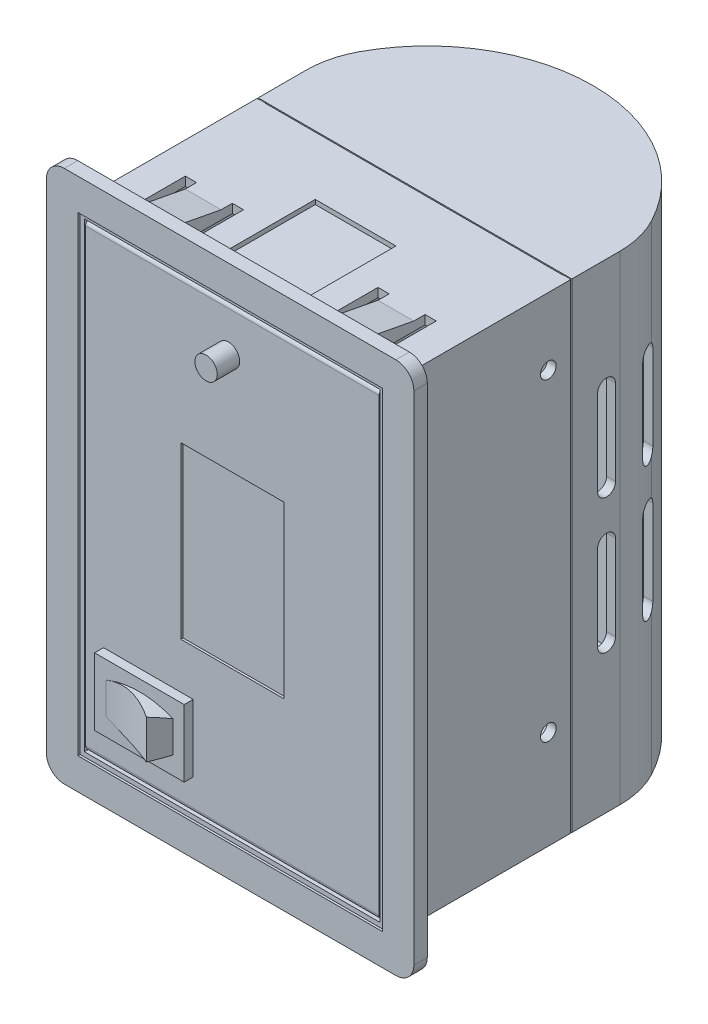
from build123d import *

# Parameters (mm, degrees)
SKETCH_1_W             = 70
SKETCH_1_H             = 107
SKETCH_1_W_2           = 66
SKETCH_1_H_2           = 103
EXTRUDE_1_DEPTH        = 38
SKETCH_2_W             = 66
SKETCH_2_H             = 103
EXTRUDE_2_DEPTH        = 3
SKETCH_3_W             = 68
SKETCH_3_H             = 105
CUT_EXTRUDE_1_DEPTH    = 0.5
SKETCH_4_W             = 18
SKETCH_4_H             = 25
CUT_EXTRUDE_2_DEPTH    = 1
EXTRUDE_3_DEPTH        = 1
CUT_EXTRUDE_3_REACH    = 106.868
SKETCH_6_R             = 1.75
EXTRUDE_4_DEPTH        = 65.5
SKETCH_10_W            = 20
SKETCH_10_H            = 15
EXTRUDE_5_DEPTH        = 2
EXTRUDE_6_DEPTH        = 3.5
CUT_EXTRUDE_4_DEPTH    = 15
CUT_EXTRUDE_5_DEPTH    = 15
SKETCH_14_R            = 2.5
EXTRUDE_7_DEPTH        = 5
SKETCH_15_W            = 23
SKETCH_15_H            = 38
CUT_EXTRUDE_6_DEPTH    = 0.5
EXTRUDE_8_DEPTH        = 107
CUT_EXTRUDE_8_REACH    = 108.744
SKETCH_17_W            = 0.25
SKETCH_17_H            = 0.1
EXTRUDE_START          = -2
EXTRUDE_9_DEPTH        = 2
SKETCH_19_W            = 13
SKETCH_19_H            = 15
CUT_EXTRUDE_9_DEPTH    = 2
EXTRUDE_10_DEPTH       = 8
PATTERN_LINEAR_1_COUNT = 2
PATTERN_LINEAR_1_PITCH = 43
MIRROR_3_COPY_1_DEPTH  = 8
CUT_EXTRUDE_10_REACH   = 108.922
PATTERN_LINEAR_2_COUNT = 2
PATTERN_LINEAR_2_PITCH = 11
SKETCH_22_R            = 2.5
CUT_EXTRUDE_11_DEPTH   = 2


with BuildPart() as part:
    # Эскиз1 → Бобышка-Вытянуть1 (new body)
    with BuildSketch(Plane.XY):
        Rectangle(SKETCH_1_W, SKETCH_1_H)
        Rectangle(SKETCH_1_W_2, SKETCH_1_H_2, mode=Mode.SUBTRACT)
    extrude(amount=EXTRUDE_1_DEPTH)

    # Эскиз2 → Бобышка-Вытянуть2 (add)
    with BuildSketch(Plane.XY.offset(38)):
        with BuildLine():
            Line((-37, -59.5), (37, -59.5))
            ThreePointArc((37, -59.5), (39.828427125, -58.328427125), (41, -55.5))
            Line((41, -55.5), (41, 55.5))
            ThreePointArc((41, 55.5), (39.828427125, 58.328427125), (37, 59.5))
            Line((37, 59.5), (-37, 59.5))
            ThreePointArc((-37, 59.5), (-39.828427125, 58.328427125), (-41, 55.5))
            Line((-41, 55.5), (-41, -55.5))
            ThreePointArc((-41, -55.5), (-39.828427125, -58.328427125), (-37, -59.5))
        make_face()
        Rectangle(SKETCH_2_W, SKETCH_2_H, mode=Mode.SUBTRACT)
    extrude(amount=EXTRUDE_2_DEPTH)

    # Эскиз3 → Вырез-Вытянуть1 (cut)
    with BuildSketch(Plane.XY.offset(41)):
        Rectangle(SKETCH_3_W, SKETCH_3_H)
    extrude(amount=-CUT_EXTRUDE_1_DEPTH, mode=Mode.SUBTRACT)

    # Эскиз4 → Вырез-Вытянуть2 (cut)
    with BuildSketch(Plane(origin=(0, 53.5, 0), x_dir=(1, 0, 0), z_dir=(0, 1, 0))):
        with Locations((0, -25.5)):
            Rectangle(SKETCH_4_W, SKETCH_4_H)
    cut_extrude_2 = extrude(amount=-CUT_EXTRUDE_2_DEPTH, mode=Mode.SUBTRACT)

    # Эскиз5 → Бобышка-Вытянуть3 (add)
    with BuildSketch(Plane.XZ.offset(-51.5)):
        with BuildLine():
            Line((-10.5, 11), (10.5, 11))
            Line((10.5, 11), (10.5, 36))
            ThreePointArc((10.5, 36), (9.914213562, 37.414213562), (8.5, 38))
            Line((8.5, 38), (-8.5, 38))
            ThreePointArc((-8.5, 38), (-9.914213562, 37.414213562), (-10.5, 36))
            Line((-10.5, 36), (-10.5, 11))
        make_face()
    extrude_3 = extrude(amount=EXTRUDE_3_DEPTH)

    # Зеркальное отражение1: Вырез-Вытянуть2, Бобышка-Вытянуть3 across plane
    add(cut_extrude_2.mirror(Plane.ZX), mode=Mode.SUBTRACT)
    add(extrude_3.mirror(Plane.ZX))

    # Вырез-Вытянуть3: up to this face of the body (flat: up to its plane)
    cut_extrude_3_end = Plane(part.part.faces().sort_by_distance((35, 0, 19))[0])
    # Эскиз6 → Вырез-Вытянуть3 (cut, up to the picked face)
    with BuildSketch(Plane.ZY.offset(35), mode=Mode.PRIVATE) as cut_extrude_3_sk1:
        with Locations((5, -31.5)):
            Circle(SKETCH_6_R)
    cut_extrude_3_tool1 = split(extrude(cut_extrude_3_sk1.sketch, amount=-CUT_EXTRUDE_3_REACH, mode=Mode.PRIVATE), bisect_by=cut_extrude_3_end, keep=Keep.BOTH, mode=Mode.PRIVATE)
    # Эскиз6 → Вырез-Вытянуть3 (cut, up to the picked face)
    with BuildSketch(Plane.ZY.offset(35), mode=Mode.PRIVATE) as cut_extrude_3_sk2:
        with Locations((5, 38.5)):
            Circle(SKETCH_6_R)
    cut_extrude_3_tool2 = split(extrude(cut_extrude_3_sk2.sketch, amount=-CUT_EXTRUDE_3_REACH, mode=Mode.PRIVATE), bisect_by=cut_extrude_3_end, keep=Keep.BOTH, mode=Mode.PRIVATE)
    add(cut_extrude_3_tool1.solids().sort_by(Axis((-35, -31.5, 5), (1, 0, 0)))[0], mode=Mode.SUBTRACT)
    add(cut_extrude_3_tool2.solids().sort_by(Axis((-35, 38.5, 5), (1, 0, 0)))[0], mode=Mode.SUBTRACT)

    # Эскиз16 → Бобышка-Вытянуть8 (add)
    with BuildSketch(Plane(origin=(0, 53.5, 0), x_dir=(1, 0, 0), z_dir=(0, 1, 0))):
        with BuildLine():
            Line((35, 0.25), (35, 11))
            ThreePointArc((35, 11), (34.402850003, 15.850712501), (32.647058824, 20.411764706))
            ThreePointArc((32.647058824, 20.411764706), (0, 40), (-32.647058824, 20.411764706))
            ThreePointArc((-32.647058824, 20.411764706), (-34.402850003, 15.850712501), (-35, 11))
            Line((-35, 11), (-35, 0.25))
            Line((-35, 0.25), (-34.75, 0.25))
            Line((-34.75, 0.25), (-34.75, 0))
            Line((-34.75, 0), (-33.25, 0))
            Line((-33.25, 0), (-33.25, 0.25))
            Line((-33.25, 0.25), (-33, 0.25))
            Line((-33, 0.25), (-33, 10.821410984))
            ThreePointArc((-33, 10.821410984), (-32.321835662, 15.985388779), (-30.333333333, 20.799164015))
            ThreePointArc((-30.333333333, 20.799164015), (0, 38.33809621), (30.333333333, 20.799164015))
            ThreePointArc((30.333333333, 20.799164015), (32.321835662, 15.985388779), (33, 10.821410984))
            Line((33, 10.821410984), (33, 0.25))
            Line((33, 0.25), (33.25, 0.25))
            Line((33.25, 0.25), (33.25, 0))
            Line((33.25, 0), (34.75, 0))
            Line((34.75, 0), (34.75, 0.25))
            Line((34.75, 0.25), (35, 0.25))
        make_face()
    extrude(amount=-EXTRUDE_8_DEPTH)

    # Вырез-Вытянуть8: up to this face of the body (flat: up to its plane)
    cut_extrude_8_end = Plane(part.part.faces().sort_by_distance((34.75, 0, -0.125))[0])
    # Эскиз17 → Вырез-Вытянуть8 (cut, up to the picked face)
    with BuildSketch(Plane.ZY.offset(34.75), mode=Mode.PRIVATE) as cut_extrude_8_sk1:
        with Locations((-0.125, 53.45)):
            Rectangle(SKETCH_17_W, SKETCH_17_H)
    cut_extrude_8_tool1 = split(extrude(cut_extrude_8_sk1.sketch, amount=-CUT_EXTRUDE_8_REACH, mode=Mode.PRIVATE), bisect_by=cut_extrude_8_end, keep=Keep.BOTH, mode=Mode.PRIVATE)
    # Эскиз17 → Вырез-Вытянуть8 (cut, up to the picked face)
    with BuildSketch(Plane.ZY.offset(34.75), mode=Mode.PRIVATE) as cut_extrude_8_sk2:
        with Locations((-0.125, -53.45)):
            Rectangle(SKETCH_17_W, SKETCH_17_H)
    cut_extrude_8_tool2 = split(extrude(cut_extrude_8_sk2.sketch, amount=-CUT_EXTRUDE_8_REACH, mode=Mode.PRIVATE), bisect_by=cut_extrude_8_end, keep=Keep.BOTH, mode=Mode.PRIVATE)
    add(cut_extrude_8_tool1.solids().sort_by(Axis((-34.75, 53.45, -0.125), (1, 0, 0)))[0], mode=Mode.SUBTRACT)
    add(cut_extrude_8_tool2.solids().sort_by(Axis((-34.75, -53.45, -0.125), (1, 0, 0)))[0], mode=Mode.SUBTRACT)

    # Эскиз18 → Бобышка-Вытянуть9 (add)
    with BuildSketch(Plane.XZ.offset(53.5).offset(EXTRUDE_START)):
        with BuildLine():
            Line((-33, -0.25), (-33, -10.821410984))
            ThreePointArc((-33, -10.821410984), (-32.321835662, -15.985388779), (-30.333333333, -20.799164015))
            ThreePointArc((-30.333333333, -20.799164015), (0, -38.33809621), (30.333333333, -20.799164015))
            ThreePointArc((30.333333333, -20.799164015), (32.321835662, -15.985388779), (33, -10.821410984))
            Line((33, -10.821410984), (33, -0.25))
            Line((33, -0.25), (-33, -0.25))
        make_face()
    extrude_9 = extrude(amount=EXTRUDE_9_DEPTH)

    # Зеркальное отражение2: Бобышка-Вытянуть9 across plane
    add(extrude_9.mirror(Plane.ZX))

    # Эскиз19 → Вырез-Вытянуть9 (cut)
    with BuildSketch(Plane(origin=(0, 53.5, 0), x_dir=(1, 0, 0), z_dir=(0, 1, 0))):
        with Locations((-21.5, -30.5)):
            Rectangle(SKETCH_19_W, SKETCH_19_H)
        with Locations((21.5, -30.5)):
            Rectangle(SKETCH_19_W, SKETCH_19_H)
    cut_extrude_9 = extrude(amount=-CUT_EXTRUDE_9_DEPTH, mode=Mode.SUBTRACT)

    # Эскиз20 → Бобышка-Вытянуть10 (add)
    with BuildSketch(Plane.ZY.offset(17.5)):
        Polygon((23, 53.5), (23, 51.5), (37.5, 51.5), (37.5, 53.5), (35.5, 55.406418833), (25.5, 53.5), align=None)
    extrude_10 = extrude(amount=EXTRUDE_10_DEPTH)

    # Линейный массив1: Бобышка-Вытянуть10 ×2
    with Locations(*[(i * PATTERN_LINEAR_1_PITCH, 0, 0) for i in range(1, PATTERN_LINEAR_1_COUNT)]):
        add(extrude_10)

    # Зеркальное отражение3: Вырез-Вытянуть9, Бобышка-Вытянуть10 across plane
    add(cut_extrude_9.mirror(Plane.ZX), mode=Mode.SUBTRACT)
    add(extrude_10.mirror(Plane.ZX))

    # Зеркальное отражение3 copy 1 sketch → Зеркальное отражение3 copy 1 (add)
    with BuildSketch(Plane.ZY.offset(-25.5)):
        Polygon((23, -53.5), (23, -51.5), (37.5, -51.5), (37.5, -53.5), (35.5, -55.406418833), (25.5, -53.5), align=None)
    extrude(amount=MIRROR_3_COPY_1_DEPTH)

    # Вырез-Вытянуть10: up to this face of the body (flat: up to its plane)
    cut_extrude_10_end = Plane(part.part.faces().sort_by_distance((35, 0, -5.625))[0])
    # Эскиз21 → Вырез-Вытянуть10 (cut, up to the picked face)
    with BuildSketch(Plane.ZY.offset(35), mode=Mode.PRIVATE) as cut_extrude_10_sk1:
        with BuildLine():
            Line((-6, 28.5), (-6, 9.5))
            ThreePointArc((-6, 9.5), (-8, 7.5), (-10, 9.5))
            Line((-10, 9.5), (-10, 28.5))
            ThreePointArc((-10, 28.5), (-8, 30.5), (-6, 28.5))
        make_face()
    cut_extrude_10_tool1 = split(extrude(cut_extrude_10_sk1.sketch, amount=-CUT_EXTRUDE_10_REACH, mode=Mode.PRIVATE), bisect_by=cut_extrude_10_end, keep=Keep.BOTH, mode=Mode.PRIVATE)
    # Эскиз21 → Вырез-Вытянуть10 (cut, up to the picked face)
    with BuildSketch(Plane.ZY.offset(35), mode=Mode.PRIVATE) as cut_extrude_10_sk2:
        with BuildLine():
            Line((-6, -1.5), (-6, -20.5))
            ThreePointArc((-6, -20.5), (-8, -22.5), (-10, -20.5))
            Line((-10, -20.5), (-10, -1.5))
            ThreePointArc((-10, -1.5), (-8, 0.5), (-6, -1.5))
        make_face()
    cut_extrude_10_tool2 = split(extrude(cut_extrude_10_sk2.sketch, amount=-CUT_EXTRUDE_10_REACH, mode=Mode.PRIVATE), bisect_by=cut_extrude_10_end, keep=Keep.BOTH, mode=Mode.PRIVATE)
    cut_extrude_10_1 = cut_extrude_10_tool1.solids().sort_by(Axis((-35, 19, -8), (1, 0, 0)))[0]
    add(cut_extrude_10_1, mode=Mode.SUBTRACT)
    cut_extrude_10_2 = cut_extrude_10_tool2.solids().sort_by(Axis((-35, -11, -8), (1, 0, 0)))[0]
    add(cut_extrude_10_2, mode=Mode.SUBTRACT)
    cut_extrude_10 = cut_extrude_10_1 + cut_extrude_10_2  # Вырез-Вытянуть10 as one shape, for the pattern or mirror that repeats it

    # Линейный массив2: Вырез-Вытянуть10 ×2
    with Locations(*[(0, 0, -i * PATTERN_LINEAR_2_PITCH) for i in range(1, PATTERN_LINEAR_2_COUNT)]):
        add(cut_extrude_10, mode=Mode.SUBTRACT)

    # Эскиз22 → Вырез-Вытянуть11 (cut)
    with BuildSketch(Plane.XZ.offset(53.5)):
        with Locations(Location((21.5, 16.5, 0), (0, 0, 270))):
            Circle(SKETCH_22_R)
        with Locations(Location((21.5, 6.5, 0), (0, 0, 270))):
            Circle(SKETCH_22_R)
    extrude(amount=-CUT_EXTRUDE_11_DEPTH, mode=Mode.SUBTRACT)


with BuildPart() as body_2:
    # Эскиз9 → Бобышка-Вытянуть4 (new body)
    with BuildSketch(Plane(origin=(-32.75, 0, 0), x_dir=(0, 0, -1), z_dir=(1, 0, 0))):
        with BuildLine():
            Line((-38.5, -51.25), (-38.5, 51.25))
            Line((-38.5, 51.25), (-39.5, 51.25))
            ThreePointArc((-39.5, 51.25), (-40.207106781, 50.957106781), (-40.5, 50.25))
            Line((-40.5, 50.25), (-40.5, -50.25))
            ThreePointArc((-40.5, -50.25), (-40.207106781, -50.957106781), (-39.5, -51.25))
            Line((-39.5, -51.25), (-38.5, -51.25))
        make_face()
    extrude(amount=EXTRUDE_4_DEPTH)

    # Эскиз10 → Бобышка-Вытянуть5 (add)
    with BuildSketch(Plane.XY.offset(40.5)):
        with Locations((-18.75, -36.75)):
            Rectangle(SKETCH_10_W, SKETCH_10_H)
    extrude(amount=EXTRUDE_5_DEPTH)

    # Эскиз11 → Бобышка-Вытянуть6 (add)
    with BuildSketch(Plane.XY.offset(42.5)):
        with BuildLine():
            Line((-26.25, -40.25), (-26.25, -33.25))
            ThreePointArc((-26.25, -33.25), (-18.75, -31.75), (-11.25, -33.25))
            Line((-11.25, -33.25), (-11.25, -40.25))
            ThreePointArc((-11.25, -40.25), (-18.75, -41.75), (-26.25, -40.25))
        make_face()
    extrude(amount=EXTRUDE_6_DEPTH)

    # Эскиз12 → Вырез-Вытянуть4 (cut)
    with BuildSketch(Plane.XZ.offset(44.25)):
        with BuildLine():
            Line((-26.25, 42.5), (-26.25, 46))
            Line((-26.25, 46), (-13.700726384, 46))
            ThreePointArc((-13.700726384, 46), (-19.744971321, 43.423928393), (-26.25, 42.5))
        make_face()
    extrude(amount=-CUT_EXTRUDE_4_DEPTH, mode=Mode.SUBTRACT)

    # Эскиз13 → Вырез-Вытянуть5 (cut)
    with BuildSketch(Plane.XZ.offset(44.25)):
        Polygon((-13.700726384, 46), (-11.25, 42.5), (-11.25, 46), align=None)
    extrude(amount=-CUT_EXTRUDE_5_DEPTH, mode=Mode.SUBTRACT)

    # Эскиз14 → Бобышка-Вытянуть7 (add)
    with BuildSketch(Plane.XY.offset(40.5)):
        with Locations(Location((-0.865298915, 41.25, 0), (0, 0, 90))):
            Circle(SKETCH_14_R)
    extrude(amount=EXTRUDE_7_DEPTH)

    # Эскиз15 → Вырез-Вытянуть6 (cut)
    with BuildSketch(Plane.XY.offset(40.5)):
        Rectangle(SKETCH_15_W, SKETCH_15_H)
    extrude(amount=-CUT_EXTRUDE_6_DEPTH, mode=Mode.SUBTRACT)


solid = Compound([part.part, body_2.part])
